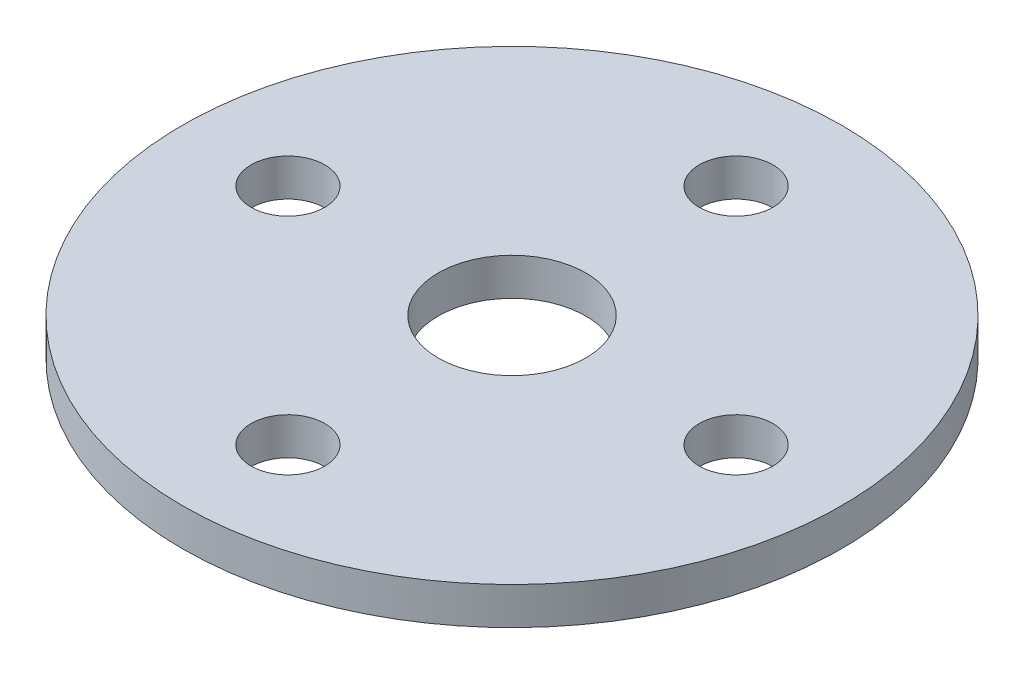
from build123d import *

# Parameters (mm, degrees)
SKETCH1_R           = 17.65
SKETCH1_R_2         = 3.95
SKETCH1_R_3         = 1.975
BOSS_EXTRUDE1_DEPTH = 2


with BuildPart() as part:
    # Sketch1 → Boss-Extrude1 (new body)
    with BuildSketch(Plane(origin=(0, 0, 0), x_dir=(1, 0, 0), z_dir=(0, 1, 0))):
        with Locations(Location((0, 0, 0), (0, 0, 270))):
            Circle(SKETCH1_R)
        with Locations(Location((0, 0, 0), (0, 0, 270))):
            Circle(SKETCH1_R_2, mode=Mode.SUBTRACT)
        with Locations(Location((0, 12, 0), (0, 0, 270))):
            Circle(SKETCH1_R_3, mode=Mode.SUBTRACT)
        with Locations(Location((-12, 0, 0), (0, 0, 270))):
            Circle(SKETCH1_R_3, mode=Mode.SUBTRACT)
        with Locations(Location((12, 0, 0), (0, 0, 90))):
            Circle(SKETCH1_R_3, mode=Mode.SUBTRACT)
        with Locations(Location((0, -12, 0), (0, 0, 90))):
            Circle(SKETCH1_R_3, mode=Mode.SUBTRACT)
    extrude(amount=BOSS_EXTRUDE1_DEPTH)


solid = part.part
